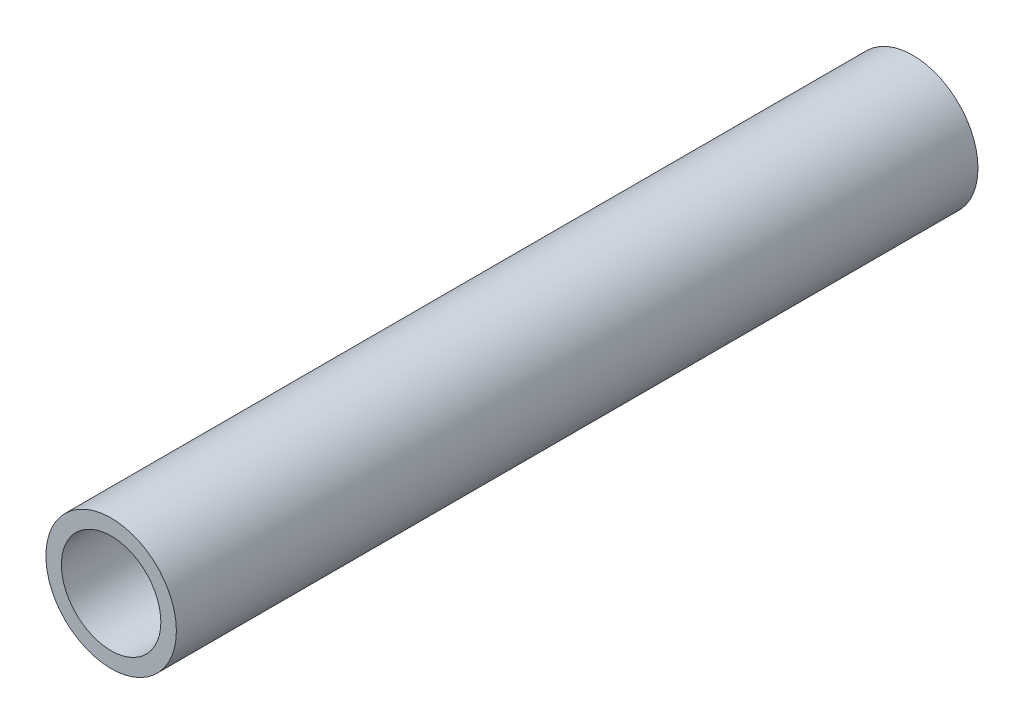
from build123d import *

# Parameters (mm, degrees)
SKETCH_1_R      = 5.25
SKETCH_1_R_2    = 4
EXTRUDE_1_DEPTH = 32.25


with BuildPart() as part:
    # 草图1 → 拉伸1 (new, symmetric)
    with BuildSketch(Plane.XY):
        Circle(SKETCH_1_R)
        Circle(SKETCH_1_R_2, mode=Mode.SUBTRACT)
    extrude(amount=EXTRUDE_1_DEPTH, both=True)


solid = part.part
